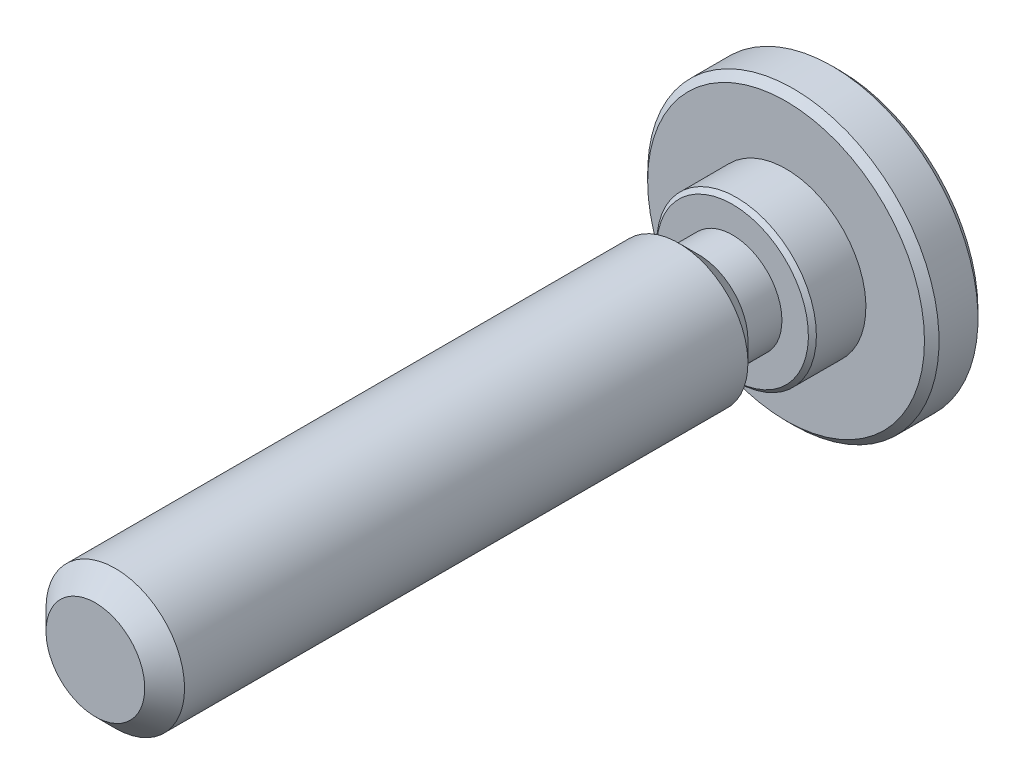
from build123d import *

# Parameters (mm, degrees)
CHAMFER2_SIZE      = 0.5953125
CUT_EXTRUDE1_DEPTH = 1.48828125
CHAMFER1_SIZE      = 0.217805
CHAMFER3_SIZE      = 0.11938


with BuildPart() as part:
    # Sketch13 → Revolve1 (revolve)
    with BuildSketch(Plane(origin=(0, 0, 0), x_dir=(0, 0, -1), z_dir=(1, 0, 0))):
        Polygon((1.6002, 4.3561), (0, 4.3561), (0, 2.3876), (-1.6002, 2.3876), (-1.6002, 1.4760575), (-2.6162, 1.4760575), (-3.2115125, 2.07137), (-20.6502, 2.07137), (-20.6502, 0), (1.6002, 0), align=None)
    revolve(axis=Axis((0, 0, 20.6502), (0, 0, -1)))

    # Chamfer2
    chamfer2_edges = [part.edges().sort_by_distance(p)[0] for p in [
        (0, -2.07137, 20.6502),
    ]]
    chamfer(chamfer2_edges, length=CHAMFER2_SIZE)

    # Sketch7 → Cut-Extrude1 (cut)
    with BuildSketch(Plane(origin=(0, 0, -1.6002), x_dir=(-1, 0, 0), z_dir=(0, 0, -1))):
        Polygon((0, 1.14567944), (-0.9921875, 0.57283972), (-0.9921875, -0.57283972), (0, -1.14567944), (0.9921875, -0.57283972), (0.9921875, 0.57283972), align=None)
    extrude(amount=-CUT_EXTRUDE1_DEPTH, mode=Mode.SUBTRACT)

    # Chamfer1
    chamfer1_edges = [part.edges().sort_by_distance(p)[0] for p in [
        (0, -4.3561, -1.6002),
        (0, -4.3561, 0),
    ]]
    chamfer(chamfer1_edges, length=CHAMFER1_SIZE)

    # Cut-Extrude2 cone 1 section (through the dimple's axis) → Cut-Extrude2 (revolve, cut)
    with BuildSketch(Plane(origin=(0, 0, -1.6002), x_dir=(0, 1, 0), z_dir=(1, 0, 0))):
        Polygon((0, 0), (1.14567944, 0), (0, 1.14567944), align=None)
    revolve(axis=Axis((0, 0, -1.6002), (0, 0, 1)), mode=Mode.SUBTRACT)

    # Chamfer3
    chamfer3_edges = [part.edges().sort_by_distance(p)[0] for p in [
        (0, -2.3876, 1.6002),
    ]]
    chamfer(chamfer3_edges, length=CHAMFER3_SIZE)


solid = part.part
